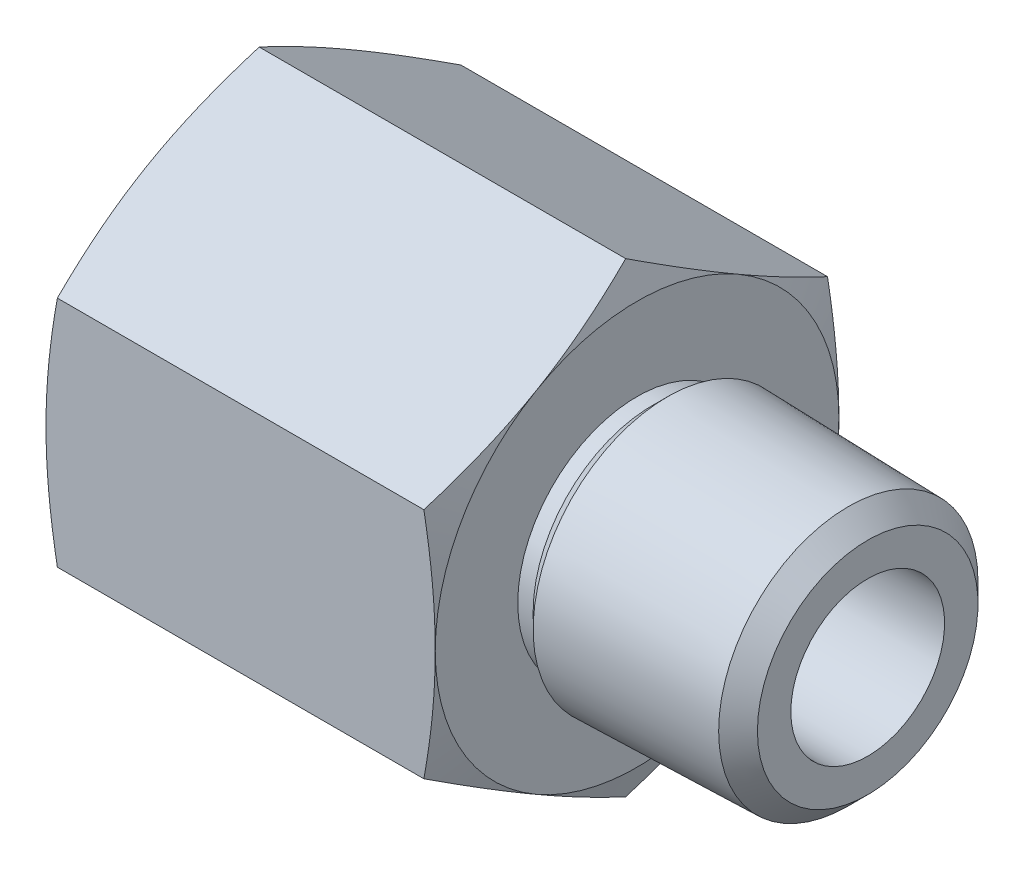
from build123d import *

# Parameters (mm, degrees)
EXTRUDE1_DEPTH     = 32.146875
SKETCH3_OUTSIDE_W  = 278.22
SKETCH3_OUTSIDE_H  = 283.376
SKETCH3_OUTSIDE_R  = 16.66875
CUT_EXTRUDE1_DEPTH = 42.008923024
CUT_EXTRUDE1_DRAFT = -70
SKETCH4_OUTSIDE_W  = 278.22
SKETCH4_OUTSIDE_H  = 283.376
SKETCH4_OUTSIDE_R  = 16.66875
CUT_EXTRUDE2_DEPTH = 42.008923024
CUT_EXTRUDE2_DRAFT = -70
SKETCH5_R          = 10.668
EXTRUDE2_DEPTH     = 19.05
EXTRUDE2_DRAFT     = 1.5
SKETCH7_R          = 13.335
CUT_EXTRUDE4_DEPTH = 46.191749083
CUT_EXTRUDE4_DRAFT = 1.5
SKETCH12_W         = 6.35
SKETCH12_H         = 19.247414599
SKETCH15_R         = 13.926557298
CUT_EXTRUDE7_DEPTH = 5.08
CUT_EXTRUDE7_DRAFT = -45


with BuildPart() as part:
    # Sketch2 → Extrude1 (new body)
    with BuildSketch(Plane(origin=(-25.5984375, 0, 0), x_dir=(0, 0, -1), z_dir=(1, 0, 0))):
        Polygon((0, 19.247414599), (-16.66875, 9.6237073), (-16.66875, -9.6237073), (0, -19.247414599), (16.66875, -9.6237073), (16.66875, 9.6237073), align=None)
    extrude(amount=EXTRUDE1_DEPTH)


with BuildPart() as cut_extrude1_tool:
    # Sketch3 outside → Cut-Extrude1 (with draft: the straight prism first)
    with BuildSketch(Plane(origin=(6.5484375, 0, 0), x_dir=(0, 0, -1), z_dir=(1, 0, 0))):
        Rectangle(SKETCH3_OUTSIDE_W, SKETCH3_OUTSIDE_H)
        Circle(SKETCH3_OUTSIDE_R, mode=Mode.SUBTRACT)
    extrude(amount=-CUT_EXTRUDE1_DEPTH)
    # Cut-Extrude1: the draft: its side faces are tilted about the plane it starts from
    cut_extrude1_sides = [cut_extrude1_tool.faces().sort_by_distance(p)[0] for p in [
        (-14.456024012, -141.688, 0),
        (-14.456024012, 0, -139.11),
        (-14.456024012, 141.688, 0),
        (-14.456024012, 0, 139.11),
        (-14.456024012, 0, 16.66875),
    ]]
    draft(cut_extrude1_sides, Plane(origin=(6.5484375, 0, 0), x_dir=(0, 0, -1), z_dir=(1, 0, 0)), CUT_EXTRUDE1_DRAFT)


with BuildPart() as part_1:
    add(part.part)

    # Cut-Extrude1: cut by cut_extrude1_tool
    add(cut_extrude1_tool.part, mode=Mode.SUBTRACT)


with BuildPart() as cut_extrude2_tool:
    # Sketch4 outside → Cut-Extrude2 (with draft: the straight prism first)
    with BuildSketch(Plane.ZY.offset(25.5984375)):
        Rectangle(SKETCH4_OUTSIDE_W, SKETCH4_OUTSIDE_H)
        Circle(SKETCH4_OUTSIDE_R, mode=Mode.SUBTRACT)
    extrude(amount=-CUT_EXTRUDE2_DEPTH)
    # Cut-Extrude2: the draft: its side faces are tilted about the plane it starts from
    cut_extrude2_sides = [cut_extrude2_tool.faces().sort_by_distance(p)[0] for p in [
        (-4.593975988, -141.688, 0),
        (-4.593975988, 0, 139.11),
        (-4.593975988, 141.688, 0),
        (-4.593975988, 0, -139.11),
        (-4.593975988, 0, -16.66875),
    ]]
    draft(cut_extrude2_sides, Plane.ZY.offset(25.5984375), CUT_EXTRUDE2_DRAFT)


with BuildPart() as part_2:
    add(part_1.part)

    # Cut-Extrude2: cut by cut_extrude2_tool
    add(cut_extrude2_tool.part, mode=Mode.SUBTRACT)


with BuildPart() as body_2:
    # Sketch5 → Extrude2 (with draft: the straight prism first)
    with BuildSketch(Plane(origin=(25.5984375, 0, 0), x_dir=(0, 0, -1), z_dir=(1, 0, 0))):
        Circle(SKETCH5_R)
    extrude(amount=-EXTRUDE2_DEPTH)
    # Extrude2: the draft: its side faces are tilted about the plane it starts from
    extrude2_sides = [body_2.faces().sort_by_distance(p)[0] for p in [
        (16.0734375, 0, 10.668),
    ]]
    draft(extrude2_sides, Plane(origin=(25.5984375, 0, 0), x_dir=(0, 0, -1), z_dir=(1, 0, 0)), EXTRUDE2_DRAFT)

    # Sketch17 → Cut-Revolve2 (revolve, cut)
    with BuildSketch(Plane.XY, mode=Mode.PRIVATE) as cut_revolve2_sk:
        Polygon((25.5984375, 10.979645334), (25.5984375, 9.108586861), (23.727379027, 10.979645334), align=None)
        Polygon((6.5484375, 9.853808667), (7.8184375, 9.853808667), (9.325274167, 11.360645334), (6.5484375, 11.360645334), align=None)
    revolve(cut_revolve2_sk.sketch.rotate(Axis((-25.5984375, 0, 0), (1, 0, 0)), 270), axis=Axis((-25.5984375, 0, 0), (1, 0, 0)), mode=Mode.SUBTRACT)


with BuildPart() as cut_extrude4_tool:
    # Sketch7 → Cut-Extrude4 (with draft: the straight prism first)
    with BuildSketch(Plane(origin=(-11.7376575, 0, 0), x_dir=(0, 0, -1), z_dir=(1, 0, 0))):
        Circle(SKETCH7_R)
    extrude(amount=-CUT_EXTRUDE4_DEPTH)
    # Cut-Extrude4: the draft: its side faces are tilted about the plane it starts from
    cut_extrude4_sides = [cut_extrude4_tool.faces().sort_by_distance(p)[0] for p in [
        (-34.833532041, 0, 13.335),
    ]]
    draft(cut_extrude4_sides, Plane(origin=(-11.7376575, 0, 0), x_dir=(0, 0, -1), z_dir=(1, 0, 0)), CUT_EXTRUDE4_DRAFT)


with BuildPart() as part_3:
    add(part_2.part)

    # Cut-Extrude4: cut by cut_extrude4_tool
    add(cut_extrude4_tool.part, mode=Mode.SUBTRACT)


with BuildPart() as body_2_1:
    add(body_2.part)

    # Combine1: union part
    add(part_3.part)

    # Sketch12 → Cut-Revolve1 (revolve, cut)
    with BuildSketch(Plane.XY, mode=Mode.PRIVATE) as cut_revolve1_sk:
        Polygon((-11.7376575, 12.745793431), (-11.7376575, 0), (25.5984375, 0), (25.5984375, 6.35), (-5.341864069, 6.35), align=None)
        with Locations((-28.7734375, 9.6237073)):
            Rectangle(SKETCH12_W, SKETCH12_H)
    revolve(cut_revolve1_sk.sketch.rotate(Axis((-25.5984375, 0, 0), (1, 0, 0)), 90), axis=Axis((-25.5984375, 0, 0), (1, 0, 0)), mode=Mode.SUBTRACT)


with BuildPart() as cut_extrude7_tool:
    # Sketch15 → Cut-Extrude7 (with draft: the straight prism first)
    with BuildSketch(Plane.ZY.offset(25.5984375)):
        Circle(SKETCH15_R)
    extrude(amount=-CUT_EXTRUDE7_DEPTH)
    # Cut-Extrude7: the draft: its side faces are tilted about the plane it starts from
    cut_extrude7_sides = [cut_extrude7_tool.faces().sort_by_distance(p)[0] for p in [
        (-23.0584375, 0, -13.926557298),
    ]]
    draft(cut_extrude7_sides, Plane.ZY.offset(25.5984375), CUT_EXTRUDE7_DRAFT)


with BuildPart() as body_2_2:
    add(body_2_1.part)

    # Cut-Extrude7: cut by cut_extrude7_tool
    add(cut_extrude7_tool.part, mode=Mode.SUBTRACT)


solid = body_2_2.part
